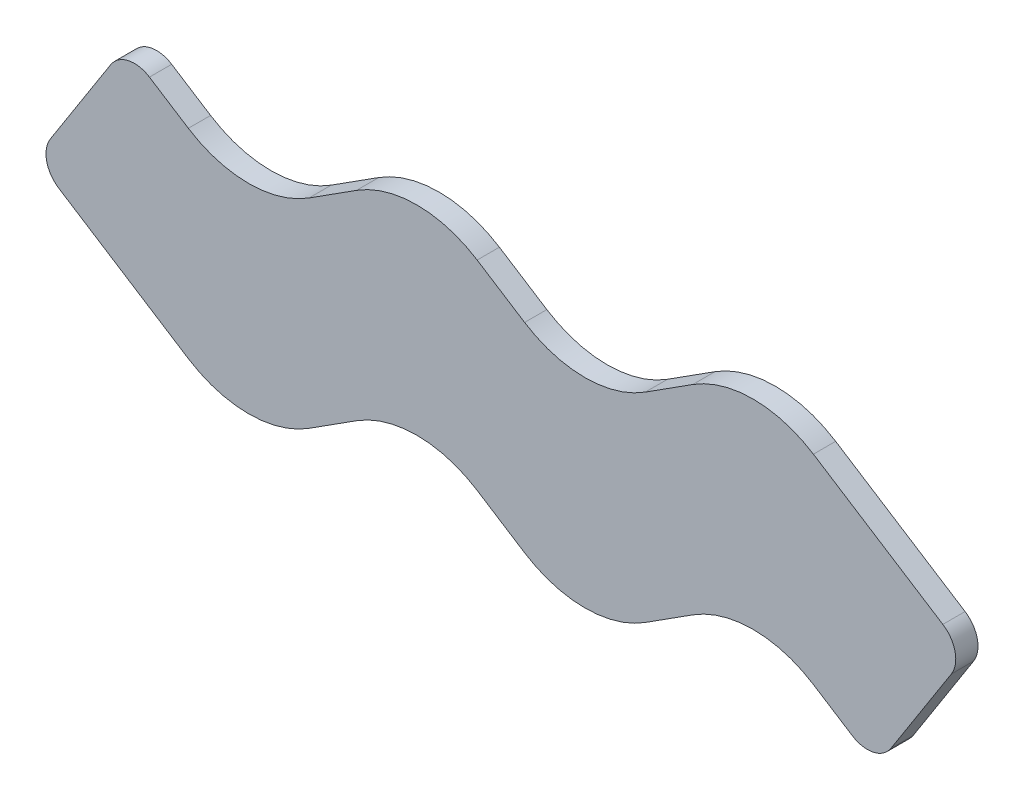
from build123d import *

# Parameters (mm, degrees)
BOSS_EXTRUDE1_DEPTH = 1.5875
FILLET1_R           = 2
FILLET3_R           = 8
FILLET4_R           = 8


with BuildPart() as part:
    # Sketch3 → Boss-Extrude1 (new body)
    with BuildSketch(Plane.XY):
        Polygon((58.775, 33.228336454), (53.202823644, 29.668334894), (46.775, 25.561669788), (40.347176356, 29.668334894), (34.775, 33.228336454), (22.775, 25.561669788), (14.005335663, 31.164510892), (7.544664337, 21.052155774), (22.775, 11.321663546), (28.347176356, 14.881665106), (34.775, 18.988330212), (41.202823644, 14.881665106), (46.775, 11.321663546), (58.775, 18.988330212), (67.544664337, 13.385489108), (74.005335663, 23.497844226), align=None)
    extrude(amount=BOSS_EXTRUDE1_DEPTH)

    # Fillet1
    fillet1_edges = [part.edges().sort_by_distance(p)[0] for p in [
        (7.544664337, 21.052155774, 0.79375),
        (14.005335663, 31.164510892, 0.79375),
        (74.005335663, 23.497844226, 0.79375),
        (67.544664337, 13.385489108, 0.79375),
    ]]
    fillet(fillet1_edges, radius=FILLET1_R)

    # Fillet3
    fillet3_edges = [part.edges().sort_by_distance(p)[0] for p in [
        (46.775, 11.321663546, 0.79375),
        (22.775, 11.321663546, 0.79375),
        (34.775, 33.228336454, 0.79375),
        (58.775, 33.228336454, 0.79375),
    ]]
    fillet(fillet3_edges, radius=FILLET3_R)

    # Fillet4
    fillet4_edges = [part.edges().sort_by_distance(p)[0] for p in [
        (34.775, 18.988330212, 0.79375),
        (22.775, 25.561669788, 0.79375),
        (46.775, 25.561669788, 0.79375),
        (58.775, 18.988330212, 0.79375),
    ]]
    fillet(fillet4_edges, radius=FILLET4_R)


solid = part.part
